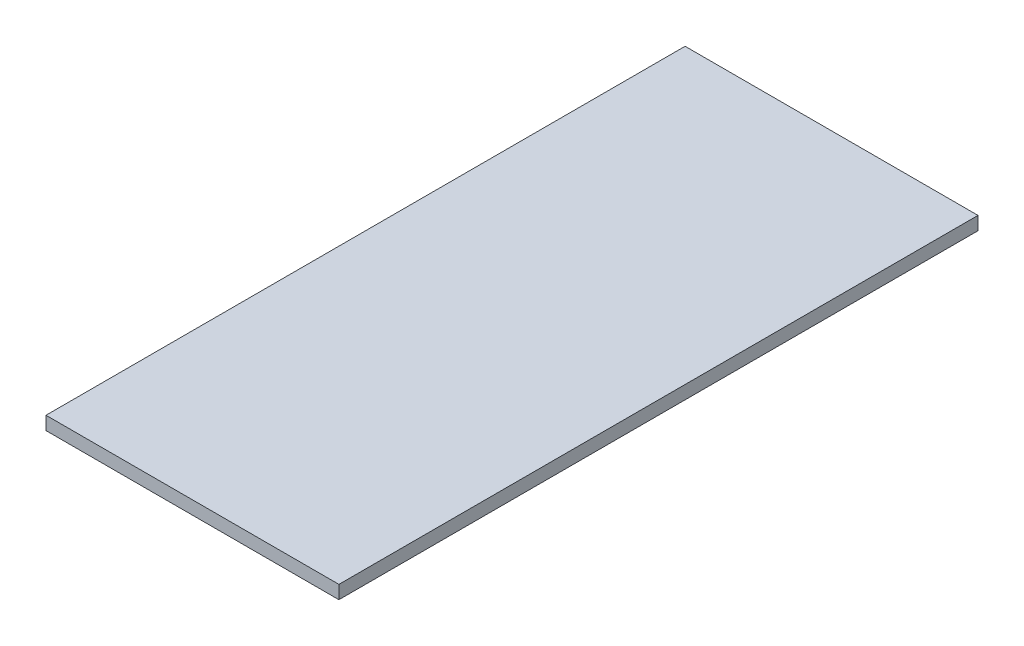
from build123d import *

# Parameters (mm, degrees)
SKETCH1_W           = 69.85
SKETCH1_H           = 152.4
BOSS_EXTRUDE1_DEPTH = 3.175


with BuildPart() as part:
    # Sketch1 → Boss-Extrude1 (new body)
    with BuildSketch(Plane(origin=(0, 0, 0), x_dir=(1, 0, 0), z_dir=(0, 1, 0))):
        with Locations((-34.925, 76.2)):
            Rectangle(SKETCH1_W, SKETCH1_H)
    extrude(amount=BOSS_EXTRUDE1_DEPTH)


solid = part.part
